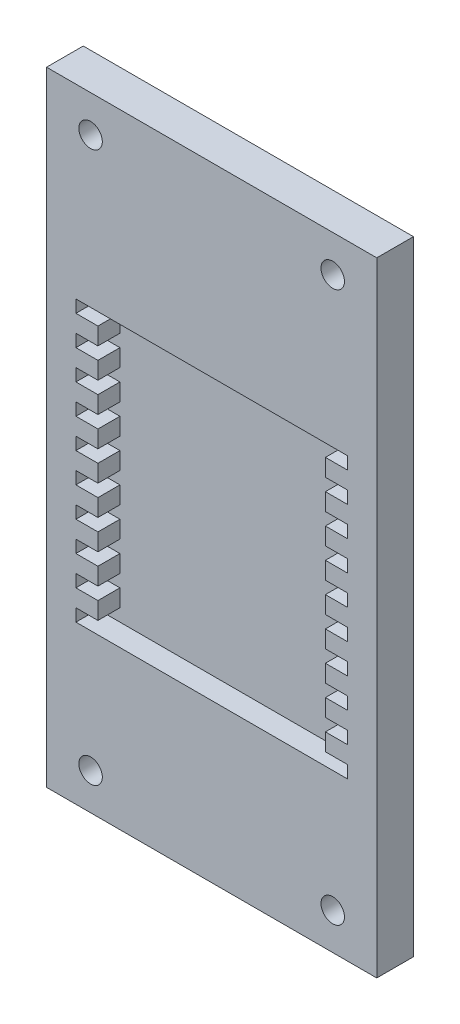
from build123d import *

# Parameters (mm, degrees)
SKIZZE1_W                       = 45
SKIZZE1_H                       = 85
AUFSATZ_LINEAR_AUSTRAGEN1_DEPTH = 5
SKIZZE6_R                       = 1.6
SCHNITT_LINEAR_AUSTRAGEN2_DEPTH = 3
SKIZZE7_W                       = 37
SKIZZE7_H                       = 1.7
SCHNITT_LINEAR_AUSTRAGEN3_DEPTH = 10
SKIZZE8_W                       = 31
SKIZZE8_H                       = 38.15
SCHNITT_LINEAR_AUSTRAGEN4_DEPTH = 10
SKIZZE9_W                       = 38.051320542
SKIZZE9_H                       = 40.768170305
AUFSATZ_LINEAR_AUSTRAGEN2_DEPTH = 2


with BuildPart() as part:
    # Skizze1 → Aufsatz-Linear austragen1 (new body)
    with BuildSketch(Plane.XY):
        with Locations((22.5, 42.5)):
            Rectangle(SKIZZE1_W, SKIZZE1_H)
    extrude(amount=AUFSATZ_LINEAR_AUSTRAGEN1_DEPTH)

    # Skizze6 → Schnitt-Linear austragen2 (cut)
    with BuildSketch(Plane.XY.offset(5)):
        with Locations((6, 80)):
            Circle(SKIZZE6_R)
        with Locations((39, 80)):
            Circle(SKIZZE6_R)
        with Locations((39, 5)):
            Circle(SKIZZE6_R)
        with Locations((6, 5)):
            Circle(SKIZZE6_R)
    extrude(amount=-SCHNITT_LINEAR_AUSTRAGEN2_DEPTH, mode=Mode.SUBTRACT)

    # Skizze7 → Schnitt-Linear austragen3 (cut)
    with BuildSketch(Plane.XY.offset(5)):
        with Locations((22.5, 58.8)):
            Rectangle(SKIZZE7_W, SKIZZE7_H)
        with Locations((22.5, 54.75)):
            Rectangle(SKIZZE7_W, SKIZZE7_H)
        with Locations((22.5, 50.7)):
            Rectangle(SKIZZE7_W, SKIZZE7_H)
        with Locations((22.5, 46.65)):
            Rectangle(SKIZZE7_W, SKIZZE7_H)
        with Locations((22.5, 42.6)):
            Rectangle(SKIZZE7_W, SKIZZE7_H)
        with Locations((22.5, 38.55)):
            Rectangle(SKIZZE7_W, SKIZZE7_H)
        with Locations((22.5, 34.5)):
            Rectangle(SKIZZE7_W, SKIZZE7_H)
        with Locations((22.5, 30.45)):
            Rectangle(SKIZZE7_W, SKIZZE7_H)
        with Locations((22.5, 26.4)):
            Rectangle(SKIZZE7_W, SKIZZE7_H)
        with Locations((22.5, 22.35)):
            Rectangle(SKIZZE7_W, SKIZZE7_H)
    extrude(amount=-SCHNITT_LINEAR_AUSTRAGEN3_DEPTH, mode=Mode.SUBTRACT)

    # Skizze8 → Schnitt-Linear austragen4 (cut)
    with BuildSketch(Plane.XY.offset(5)):
        with Locations((22.5, 40.575)):
            Rectangle(SKIZZE8_W, SKIZZE8_H)
    extrude(amount=-SCHNITT_LINEAR_AUSTRAGEN4_DEPTH, mode=Mode.SUBTRACT)

    # Skizze9 → Aufsatz-Linear austragen2 (add)
    with BuildSketch(Plane(origin=(0, 0, 0), x_dir=(-1, 0, 0), z_dir=(0, 0, -1))):
        with Locations((-22.316575494, 40.457263066)):
            Rectangle(SKIZZE9_W, SKIZZE9_H)
    extrude(amount=-AUFSATZ_LINEAR_AUSTRAGEN2_DEPTH)


solid = part.part
